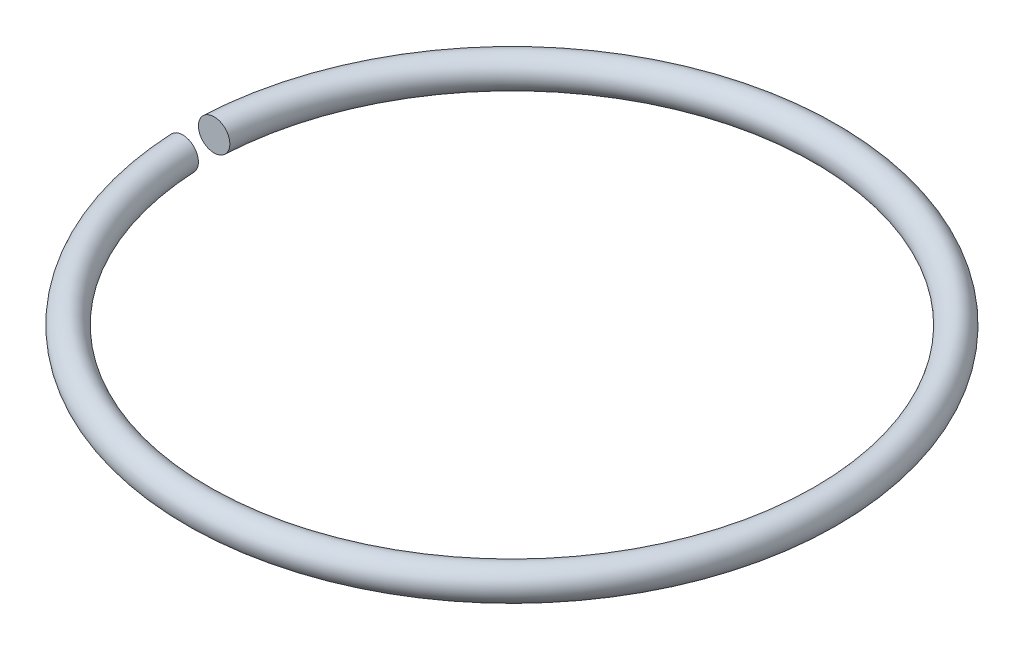
from build123d import *

# Parameters (mm, degrees)
SKETCH_1_R               = 1
CUT_EXTRUDE_1_DEPTH      = 30.76575228
CUT_EXTRUDE_1_DEPTH_BACK = 30.76575228
SKETCH_2_W               = 15.951680001
SKETCH_2_H               = 2


with BuildPart() as part:
    # Эскиз1 → Повернуть1 (revolve)
    with BuildSketch(Plane.XY, mode=Mode.PRIVATE) as revolve_1_sk:
        with Locations((-20, 1)):
            Circle(SKETCH_1_R)
    revolve(revolve_1_sk.sketch.rotate(Axis((0, 0, 0), (0, 1, 0)), 270), axis=Axis((0, 0, 0), (0, 1, 0)))

    # Эскиз2 → Вырез-Вытянуть1 (cut, two sides: drawn at the far end of the back side and taken through both)
    with BuildSketch(Plane(origin=(0, 0, 0), x_dir=(1, 0, 0), z_dir=(0, 1, 0)).offset(-CUT_EXTRUDE_1_DEPTH_BACK)):
        with Locations((-15.143088505, 0)):
            Rectangle(SKETCH_2_W, SKETCH_2_H)
    extrude(amount=CUT_EXTRUDE_1_DEPTH + CUT_EXTRUDE_1_DEPTH_BACK, mode=Mode.SUBTRACT)


solid = part.part
